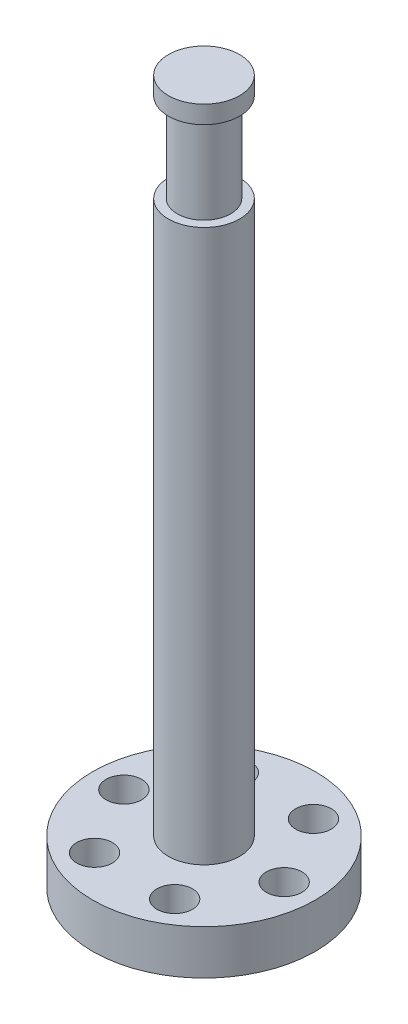
from build123d import *

# Parameters (mm, degrees)
SKETCH_1_R               = 12.5
EXTRUDE_1_DEPTH          = 79
SKETCH_2_OUTSIDE_W       = 44.31
SKETCH_2_OUTSIDE_H       = 44.31
SKETCH_2_OUTSIDE_R       = 4
CUT_EXTRUDE_2_DEPTH      = 72
SKETCH_4_OUTSIDE_W       = 44.31
SKETCH_4_OUTSIDE_H       = 44.31
SKETCH_4_OUTSIDE_R       = 4
CUT_EXTRUDE_3_DEPTH      = 80.003164494
SKETCH_6_OUTSIDE_W       = 44.31
SKETCH_6_OUTSIDE_H       = 44.31
SKETCH_6_OUTSIDE_R       = 3
CUT_EXTRUDE_4_DEPTH      = 10
SKETCH_7_R               = 2
CUT_EXTRUDE_5_DEPTH      = 81.953690466
PATTERN_CIRCULAR_1_COUNT = 6


with BuildPart() as part:
    # 草图1 → 凸台-拉伸1 (new body)
    with BuildSketch(Plane(origin=(0, 0, 0), x_dir=(1, 0, 0), z_dir=(0, 1, 0))):
        with Locations(Location((0, 0, 0), (0, 0, 270))):
            Circle(SKETCH_1_R)
    extrude(amount=EXTRUDE_1_DEPTH)

    # 草图2 outside → 切除-拉伸2 (cut)
    with BuildSketch(Plane(origin=(0, 77, 0), x_dir=(1, 0, 0), z_dir=(0, 1, 0))):
        Rectangle(SKETCH_2_OUTSIDE_W, SKETCH_2_OUTSIDE_H)
        with Locations(Location((0, 0, 0), (0, 0, 270))):
            Circle(SKETCH_2_OUTSIDE_R, mode=Mode.SUBTRACT)
    extrude(amount=-CUT_EXTRUDE_2_DEPTH, mode=Mode.SUBTRACT)

    # 草图4 outside → 切除-拉伸3 (cut, through all)
    with BuildSketch(Plane(origin=(0, 77, 0), x_dir=(1, 0, 0), z_dir=(0, 1, 0))):
        Rectangle(SKETCH_4_OUTSIDE_W, SKETCH_4_OUTSIDE_H)
        with Locations(Location((0, 0, 0), (0, 0, 270))):
            Circle(SKETCH_4_OUTSIDE_R, mode=Mode.SUBTRACT)
    extrude(amount=CUT_EXTRUDE_3_DEPTH, mode=Mode.SUBTRACT)

    # 草图6 outside → 切除-拉伸4 (cut)
    with BuildSketch(Plane(origin=(0, 77, 0), x_dir=(1, 0, 0), z_dir=(0, 1, 0))):
        Rectangle(SKETCH_6_OUTSIDE_W, SKETCH_6_OUTSIDE_H)
        with Locations(Location((0, 0, 0), (0, 0, 270))):
            Circle(SKETCH_6_OUTSIDE_R, mode=Mode.SUBTRACT)
    extrude(amount=-CUT_EXTRUDE_4_DEPTH, mode=Mode.SUBTRACT)

    # 草图7 → 切除-拉伸5 (cut, through all)
    with BuildSketch(Plane.XZ):
        with Locations(Location((9, 0, 0), (0, 0, 270))):
            Circle(SKETCH_7_R)
    cut_extrude_5 = extrude(amount=-CUT_EXTRUDE_5_DEPTH, mode=Mode.SUBTRACT)

    # 阵列(圆周)1: 切除-拉伸5 ×6 about axis
    pattern_circular_1_axis = Axis((0, 0, 0), (0, 1, 0))
    for i in range(1, PATTERN_CIRCULAR_1_COUNT):
        add(cut_extrude_5.rotate(pattern_circular_1_axis, i * 360 / PATTERN_CIRCULAR_1_COUNT), mode=Mode.SUBTRACT)


solid = part.part
